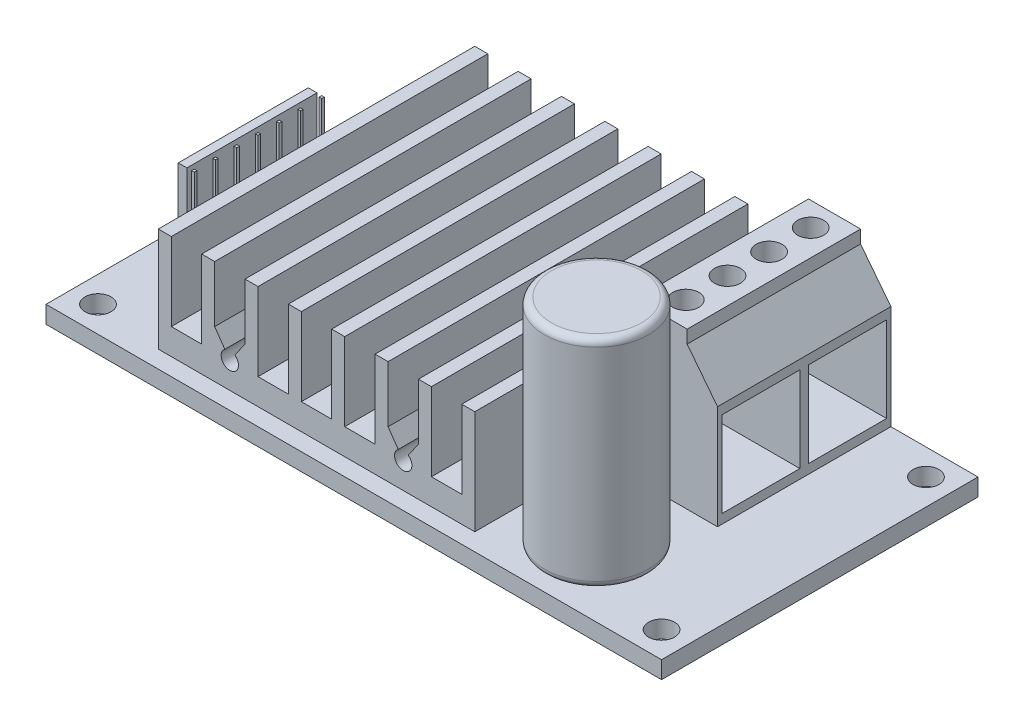
from build123d import *

# Parameters (mm, degrees)
SKETCH1_W             = 71
SKETCH1_H             = 36.5
BOARD_DEPTH           = 2
SKETCH2_R             = 1.5
SCREW_HOLES_DEPTH     = 2
FINS_DEPTH            = 36.5
SKETCH4_R             = 6
CAPACITOR_DEPTH       = 25
CAPACITOR_FILLET_R    = 0.8
FIN_SCREW_DEPTH       = 13
FIN_SCREW_DEPTH_BACK  = 4
SKETCH5_R             = 1
SKETCH7_R             = 1
FIN_SCREW_2_DEPTH     = 4
SKETCH8_W             = 5.5
SKETCH8_H             = 18
PIN_BASE_DEPTH        = 3
SKETCH9_W             = 1
SKETCH9_H             = 15
BOSS_EXTRUDE6_DEPTH   = 8
SKETCH10_W            = 0.3
SKETCH10_H            = 0.3
BOSS_EXTRUDE7_DEPTH   = 8
BOSS_EXTRUDE7_2_DEPTH = 8
BOSS_EXTRUDE7_3_DEPTH = 8
BOSS_EXTRUDE7_4_DEPTH = 8
BOSS_EXTRUDE7_5_DEPTH = 8
BOSS_EXTRUDE7_6_DEPTH = 8
BOSS_EXTRUDE7_7_DEPTH = 8
SKETCH11_R            = 1
BOSS_EXTRUDE8_DEPTH   = 7
BOSS_EXTRUDE8_2_DEPTH = 7
BOSS_EXTRUDE9_DEPTH   = 20
SKETCH13_W            = 9
SKETCH13_H            = 9.8618237
CUT_EXTRUDE1_DEPTH    = 9
SKETCH14_R            = 1.5
CUT_EXTRUDE2_DEPTH    = 9


with BuildPart() as part:
    # Sketch1 → Board (new body)
    with BuildSketch(Plane(origin=(0, 0, 0), x_dir=(1, 0, 0), z_dir=(0, 1, 0))):
        Rectangle(SKETCH1_W, SKETCH1_H)
    extrude(amount=BOARD_DEPTH)

    # Sketch2 → Screw Holes (cut)
    with BuildSketch(Plane(origin=(0, 2, 0), x_dir=(1, 0, 0), z_dir=(0, 1, 0))):
        with Locations(Location((-32.5, 15.25, 0), (0, 0, 270))):
            Circle(SKETCH2_R)
        with Locations(Location((32.5, 15.25, 0), (0, 0, 90))):
            Circle(SKETCH2_R)
        with Locations(Location((32.5, -15.25, 0), (0, 0, 270))):
            Circle(SKETCH2_R)
        with Locations(Location((-32.5, -15.25, 0), (0, 0, 90))):
            Circle(SKETCH2_R)
    extrude(amount=-SCREW_HOLES_DEPTH, mode=Mode.SUBTRACT)

    # Sketch5 → Fin Screw (cut, two sides: drawn at the far end of the back side and taken through both)
    with BuildSketch(Plane(origin=(0, 2, 0), x_dir=(1, 0, 0), z_dir=(0, 1, 0)).offset(-FIN_SCREW_DEPTH_BACK)):
        with Locations(Location((-4.325732544, 11.25, 0), (0, 0, 90))):
            Circle(SKETCH5_R)
        with Locations(Location((-4.325732544, -11.25, 0), (0, 0, 90))):
            Circle(SKETCH5_R)
    extrude(amount=FIN_SCREW_DEPTH + FIN_SCREW_DEPTH_BACK, mode=Mode.SUBTRACT)


with BuildPart() as body_2:
    # Sketch3 → Fins (new body)
    with BuildSketch(Plane.XY.offset(18.25)):
        with BuildLine():
            ThreePointArc((5.131499935, 7.819152044), (5.705076372, 6), (6.278652808, 7.819152044))
            Line((6.278652808, 7.819152044), (7.455076372, 9.499259012))
            Line((7.455076372, 9.499259012), (7.455076372, 16))
            Line((7.455076372, 16), (8.955076372, 16))
            Line((8.955076372, 16), (8.955076372, 7))
            Line((8.955076372, 7), (12.455076372, 7))
            Line((12.455076372, 7), (12.455076372, 16))
            Line((12.455076372, 16), (13.955076372, 16))
            Line((13.955076372, 16), (13.955076372, 4))
            Line((13.955076372, 4), (-22.544923628, 4))
            Line((-22.544923628, 4), (-22.544923628, 16))
            Line((-22.544923628, 16), (-21.044923628, 16))
            Line((-21.044923628, 16), (-21.044923628, 7))
            Line((-21.044923628, 7), (-17.544923628, 7))
            Line((-17.544923628, 7), (-17.544923628, 16))
            Line((-17.544923628, 16), (-16.044923628, 16))
            Line((-16.044923628, 16), (-16.044923628, 9.499259012))
            Line((-16.044923628, 9.499259012), (-14.868500065, 7.819152044))
            ThreePointArc((-14.868500065, 7.819152044), (-14.294923628, 6), (-13.721347192, 7.819152044))
            Line((-13.721347192, 7.819152044), (-12.544923628, 9.499259012))
            Line((-12.544923628, 9.499259012), (-12.544923628, 16))
            Line((-12.544923628, 16), (-11.044923628, 16))
            Line((-11.044923628, 16), (-11.044923628, 7))
            Line((-11.044923628, 7), (-7.544923628, 7))
            Line((-7.544923628, 7), (-7.544923628, 16))
            Line((-7.544923628, 16), (-6.044923628, 16))
            Line((-6.044923628, 16), (-6.044923628, 7))
            Line((-6.044923628, 7), (-2.544923628, 7))
            Line((-2.544923628, 7), (-2.544923628, 16))
            Line((-2.544923628, 16), (-1.044923628, 16))
            Line((-1.044923628, 16), (-1.044923628, 7))
            Line((-1.044923628, 7), (2.455076372, 7))
            Line((2.455076372, 7), (2.455076372, 16))
            Line((2.455076372, 16), (3.955076372, 16))
            Line((3.955076372, 16), (3.955076372, 9.499259012))
            Line((3.955076372, 9.499259012), (5.131499935, 7.819152044))
        make_face()
    extrude(amount=-FINS_DEPTH)

    # Sketch7 → Fin Screw 2 (cut)
    with BuildSketch(Plane(origin=(0, 7, 0), x_dir=(1, 0, 0), z_dir=(0, 1, 0))):
        with Locations(Location((-4.325732544, -11.25, 0), (0, 0, 270))):
            Circle(SKETCH7_R)
        with Locations(Location((-4.325732544, 11.25, 0), (0, 0, 270))):
            Circle(SKETCH7_R)
    extrude(amount=-FIN_SCREW_2_DEPTH, mode=Mode.SUBTRACT)


with BuildPart() as body_3:
    # Sketch4 → capacitor (new body)
    with BuildSketch(Plane(origin=(0, 2, 0), x_dir=(1, 0, 0), z_dir=(0, 1, 0))):
        with Locations(Location((20.5, -10.75, 0), (0, 0, 270))):
            Circle(SKETCH4_R)
    extrude(amount=CAPACITOR_DEPTH)

    # capacitor fillet
    capacitor_fillet_edges = [body_3.edges().sort_by_distance(p)[0] for p in [
        (20.5, 2, 4.75),
        (20.5, 27, 4.75),
    ]]
    fillet(capacitor_fillet_edges, radius=CAPACITOR_FILLET_R)


with BuildPart() as body_4:
    # Sketch8 → Pin Base (new body)
    with BuildSketch(Plane(origin=(0, 2, 0), x_dir=(1, 0, 0), z_dir=(0, 1, 0))):
        with Locations((-28.25, 0)):
            Rectangle(SKETCH8_W, SKETCH8_H)
    extrude(amount=PIN_BASE_DEPTH)


with BuildPart() as body_5:
    # Sketch9 → Boss-Extrude6 (new body)
    with BuildSketch(Plane(origin=(0, 5, 0), x_dir=(1, 0, 0), z_dir=(0, 1, 0))):
        with Locations((-30.5, 0)):
            Rectangle(SKETCH9_W, SKETCH9_H)
    extrude(amount=BOSS_EXTRUDE6_DEPTH)


with BuildPart() as body_6:
    # Sketch10 → Boss-Extrude7 (new body)
    with BuildSketch(Plane(origin=(0, 5, 0), x_dir=(1, 0, 0), z_dir=(0, 1, 0))):
        with Locations((-29.3, -7.35)):
            Rectangle(SKETCH10_W, SKETCH10_H)
    extrude(amount=BOSS_EXTRUDE7_DEPTH)


with BuildPart() as body_7:
    # Sketch10 → Boss-Extrude7 2 (new body)
    with BuildSketch(Plane(origin=(0, 5, 0), x_dir=(1, 0, 0), z_dir=(0, 1, 0))):
        with Locations((-29.3, -4.9)):
            Rectangle(SKETCH10_W, SKETCH10_H)
    extrude(amount=BOSS_EXTRUDE7_2_DEPTH)


with BuildPart() as body_8:
    # Sketch10 → Boss-Extrude7 3 (new body)
    with BuildSketch(Plane(origin=(0, 5, 0), x_dir=(1, 0, 0), z_dir=(0, 1, 0))):
        with Locations((-29.3, -2.45)):
            Rectangle(SKETCH10_W, SKETCH10_H)
    extrude(amount=BOSS_EXTRUDE7_3_DEPTH)


with BuildPart() as body_9:
    # Sketch10 → Boss-Extrude7 4 (new body)
    with BuildSketch(Plane(origin=(0, 5, 0), x_dir=(1, 0, 0), z_dir=(0, 1, 0))):
        with Locations((-29.3, 0)):
            Rectangle(SKETCH10_W, SKETCH10_H)
    extrude(amount=BOSS_EXTRUDE7_4_DEPTH)


with BuildPart() as body_10:
    # Sketch10 → Boss-Extrude7 5 (new body)
    with BuildSketch(Plane(origin=(0, 5, 0), x_dir=(1, 0, 0), z_dir=(0, 1, 0))):
        with Locations((-29.3, 2.45)):
            Rectangle(SKETCH10_W, SKETCH10_H)
    extrude(amount=BOSS_EXTRUDE7_5_DEPTH)


with BuildPart() as body_11:
    # Sketch10 → Boss-Extrude7 6 (new body)
    with BuildSketch(Plane(origin=(0, 5, 0), x_dir=(1, 0, 0), z_dir=(0, 1, 0))):
        with Locations((-29.3, 4.9)):
            Rectangle(SKETCH10_W, SKETCH10_H)
    extrude(amount=BOSS_EXTRUDE7_6_DEPTH)


with BuildPart() as body_12:
    # Sketch10 → Boss-Extrude7 7 (new body)
    with BuildSketch(Plane(origin=(0, 5, 0), x_dir=(1, 0, 0), z_dir=(0, 1, 0))):
        with Locations((-29.3, 7.35)):
            Rectangle(SKETCH10_W, SKETCH10_H)
    extrude(amount=BOSS_EXTRUDE7_7_DEPTH)


with BuildPart() as body_13:
    # Sketch11 → Boss-Extrude8 (new body)
    with BuildSketch(Plane.XZ):
        with Locations(Location((-4.325732544, -11.25, 0), (0, 0, 270))):
            Circle(SKETCH11_R)
    extrude(amount=-BOSS_EXTRUDE8_DEPTH)


with BuildPart() as body_14:
    # Sketch11 → Boss-Extrude8 2 (new body)
    with BuildSketch(Plane.XZ):
        with Locations(Location((-4.325732544, 11.25, 0), (0, 0, 270))):
            Circle(SKETCH11_R)
    extrude(amount=-BOSS_EXTRUDE8_2_DEPTH)


with BuildPart() as body_15:
    # Sketch12 → Boss-Extrude9 (new body)
    with BuildSketch(Plane(origin=(0, 0, -18.25), x_dir=(-1, 0, 0), z_dir=(0, 0, -1))):
        Polygon((-13.955076372, 2), (-13.955076372, 12), (-15.955076372, 12), (-15.955076372, 20), (-21.955076372, 20), (-21.955076372, 18.5), (-25.455076372, 14), (-25.455076372, 2), align=None)
    extrude(amount=-BOSS_EXTRUDE9_DEPTH)

    # Sketch13 → Cut-Extrude1 (cut)
    with BuildSketch(Plane(origin=(25.455076372, 0, 0), x_dir=(0, 0, -1), z_dir=(1, 0, 0))):
        with Locations((13.25, 8)):
            Rectangle(SKETCH13_W, SKETCH13_H)
        with Locations((3.25, 8)):
            Rectangle(SKETCH13_W, SKETCH13_H)
    extrude(amount=-CUT_EXTRUDE1_DEPTH, mode=Mode.SUBTRACT)

    # Sketch14 → Cut-Extrude2 (cut)
    with BuildSketch(Plane(origin=(0, 20, 0), x_dir=(1, 0, 0), z_dir=(0, 1, 0))):
        with Locations(Location((18.955076372, 15.498289318, 0), (0, 0, 270))):
            Circle(SKETCH14_R)
        with Locations(Location((18.955076372, 10.698289318, 0), (0, 0, 270))):
            Circle(SKETCH14_R)
        with Locations(Location((18.955076372, 5.898289318, 0), (0, 0, 270))):
            Circle(SKETCH14_R)
        with Locations(Location((18.955076372, 1.098289318, 0), (0, 0, 270))):
            Circle(SKETCH14_R)
    extrude(amount=-CUT_EXTRUDE2_DEPTH, mode=Mode.SUBTRACT)


solid = Compound([part.part, body_2.part, body_3.part, body_4.part, body_5.part, body_6.part, body_7.part, body_8.part, body_9.part, body_10.part, body_11.part, body_12.part, body_13.part, body_14.part, body_15.part])
